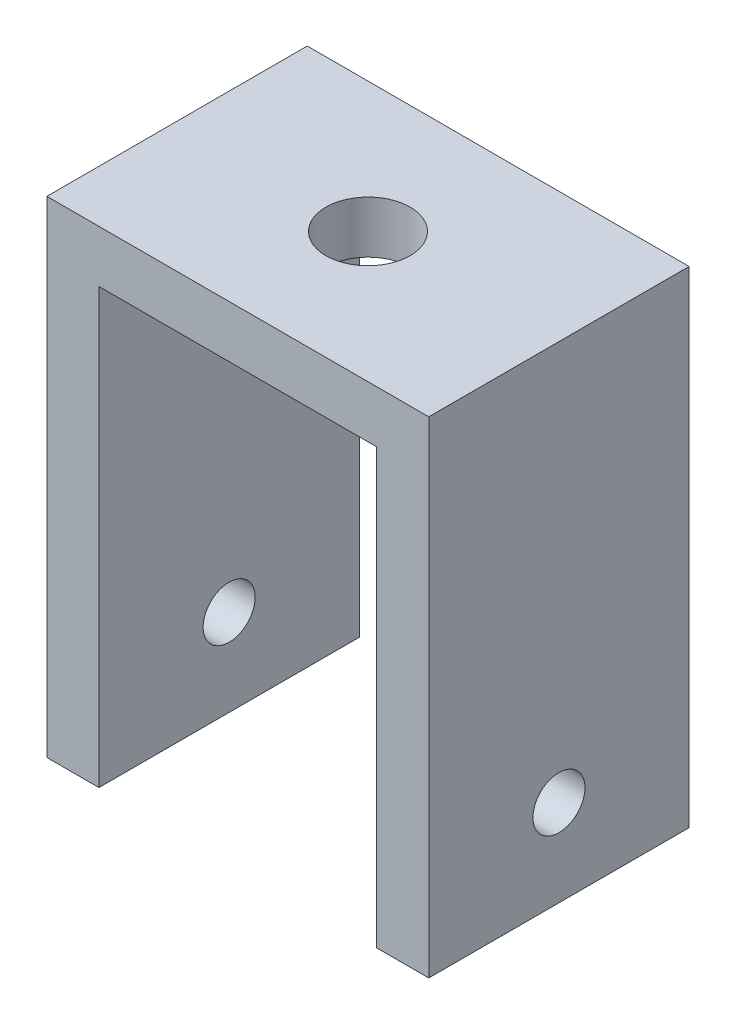
from build123d import *

# Parameters (mm, degrees)
EXTRUDE_1_DEPTH     = 15
SKETCH_2_R          = 1.5
CUT_EXTRUDE_1_DEPTH = 37.523964735
SKETCH_3_R          = 2.425
CUT_EXTRUDE_2_DEPTH = 34.615472628


with BuildPart() as part:
    # 草图1 → 凸台-拉伸1 (new body)
    with BuildSketch(Plane.XY):
        Polygon((0, 0), (8, 0), (8, -25), (11, -25), (11, 3), (0, 3), (-11, 3), (-11, -25), (-8, -25), (-8, 0), align=None)
    extrude(amount=EXTRUDE_1_DEPTH)

    # 草图2 → 切除-拉伸1 (cut, through all)
    with BuildSketch(Plane(origin=(11, 0, 0), x_dir=(0, 0, -1), z_dir=(1, 0, 0))):
        with Locations((-7.5, -20)):
            Circle(SKETCH_2_R)
    extrude(amount=-CUT_EXTRUDE_1_DEPTH, mode=Mode.SUBTRACT)

    # 草图3 → 切除-拉伸2 (cut, through all)
    with BuildSketch(Plane(origin=(0, 3, 0), x_dir=(1, 0, 0), z_dir=(0, 1, 0))):
        with Locations(Location((0, -7.5, 0), (0, 0, 270))):
            Circle(SKETCH_3_R)
    extrude(amount=-CUT_EXTRUDE_2_DEPTH, mode=Mode.SUBTRACT)


solid = part.part
